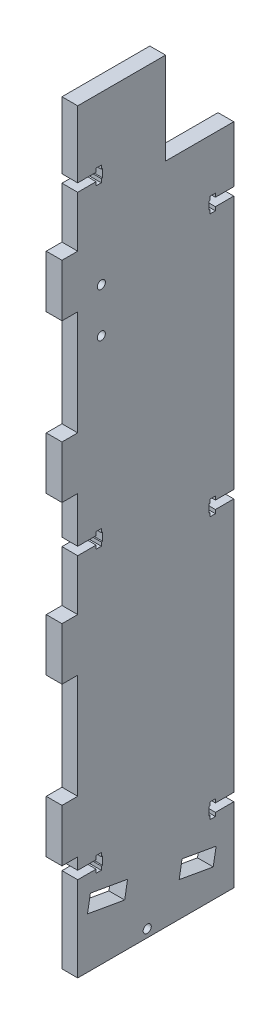
from build123d import *

# Parameters (mm, degrees)
DODANIE_WYCI_GNI_CIE1_DEPTH      = 65
DODANIE_WYCI_GNI_CIE1_DEPTH_BACK = 6.5
SZKIC1_W                         = 6
SZKIC1_H                         = 318
WYTNIJ_WYCI_GNI_CIE1_DEPTH       = 6
SZKIC4_W                         = 6
SZKIC4_H                         = 253
WYTNIJ_WYCI_GNI_CIE2_DEPTH       = 6
WYTNIJ_WYCI_GNI_CIE3_DEPTH       = 6
SZYK_LINIOWY2_COUNT              = 2
SZYK_LINIOWY2_PITCH              = 100
SZYK_LINIOWY2_COL_COUNT          = 2
SZYK_LINIOWY2_COL_PITCH          = 200
SZKIC6_W                         = 6
SZKIC6_H                         = 40
WYTNIJ_WYCI_GNI_CIE4_DEPTH       = 6
SZYK_LINIOWY3_COUNT              = 6
SZYK_LINIOWY3_PITCH              = 60
SZYK_LINIOWY3_COUNT_DIR2         = 2
SZYK_LINIOWY3_PITCH_DIR2         = 250
WYTNIJ_WYCI_GNI_CIE5_DEPTH       = 6
SZYK_LINIOWY4_COUNT              = 2
SZYK_LINIOWY4_PITCH              = 107
SZYK_LINIOWY4_COL_COUNT          = 2
SZYK_LINIOWY4_COL_PITCH          = 227
SZKIC9_R                         = 1.55
WYTNIJ_WYCI_GNI_CIE6_DEPTH       = 6
WYTNIJ_WYCI_GNI_CIE7_DEPTH       = 6
SZKIC13_R                        = 1.55
WYTNIJ_WYCI_GNI_CIE9_DEPTH       = 10


with BuildPart() as part:
    # Szkic1 → Dodanie-wyciągnięcie1 (new, two sides: drawn at the far end of the back side and taken through both)
    with BuildSketch(Plane.XY.offset(-DODANIE_WYCI_GNI_CIE1_DEPTH_BACK)):
        with Locations((-107, -325.603962956)):
            Rectangle(SZKIC1_W, SZKIC1_H)
    extrude(amount=DODANIE_WYCI_GNI_CIE1_DEPTH + DODANIE_WYCI_GNI_CIE1_DEPTH_BACK)

    # Szkic2 → Wytnij-wyciągnięcie1 (cut)
    with BuildSketch(Plane.ZY.offset(110)):
        Polygon((-6.5, -231.603962956), (25.5, -231.603962956), (25.5, -196.603962956), (65, -196.603962956), (65, -166.603962956), (-6.5, -166.603962956), align=None)
    extrude(amount=-WYTNIJ_WYCI_GNI_CIE1_DEPTH, mode=Mode.SUBTRACT)

    # Szkic4 → Wytnij-wyciągnięcie2 (cut)
    with BuildSketch(Plane.ZY.offset(110)):
        with Locations((-3.5, -358.103962956)):
            Rectangle(SZKIC4_W, SZKIC4_H)
    extrude(amount=-WYTNIJ_WYCI_GNI_CIE2_DEPTH, mode=Mode.SUBTRACT)

    # Szkic5 → Wytnij-wyciągnięcie3 (cut)
    with BuildSketch(Plane.ZY.offset(110)):
        Polygon((-0.5, -453.053962956), (-0.5, -456.153962956), (6.5, -456.153962956), (6.5, -457.528962956), (8.5, -457.528962956), (8.5, -456.153962956), (9, -456.153962956), (9, -453.053962956), (8.5, -453.053962956), (8.5, -451.678962956), (6.5, -451.678962956), (6.5, -453.053962956), align=None)
    wytnij_wyci_gni_cie3 = extrude(amount=-WYTNIJ_WYCI_GNI_CIE3_DEPTH, mode=Mode.SUBTRACT)

    # Szyk liniowy2: Wytnij-wyciągnięcie3 ×2
    with Locations(*[(0, i * SZYK_LINIOWY2_PITCH, 0) for i in range(1, SZYK_LINIOWY2_COUNT)]):
        add(wytnij_wyci_gni_cie3, mode=Mode.SUBTRACT)

    # Szyk liniowy2 col: Wytnij-wyciągnięcie3 ×2
    with Locations(*[(0, i * SZYK_LINIOWY2_COL_PITCH, 0) for i in range(1, SZYK_LINIOWY2_COL_COUNT)]):
        add(wytnij_wyci_gni_cie3, mode=Mode.SUBTRACT)

    # Szkic6 → Wytnij-wyciągnięcie4 (cut)
    with BuildSketch(Plane(origin=(-104, 0, 0), x_dir=(0, 0, -1), z_dir=(1, 0, 0))):
        with Locations((-62, -464.603962956)):
            Rectangle(SZKIC6_W, SZKIC6_H)
    wytnij_wyci_gni_cie4 = extrude(amount=-WYTNIJ_WYCI_GNI_CIE4_DEPTH, mode=Mode.SUBTRACT)

    # Szyk liniowy3: Wytnij-wyci_gni_cie4 6 × 2
    with Locations(*[Vector(0, 1, 0) * (i * SZYK_LINIOWY3_PITCH) + Vector(0, 1, 0) * (j * SZYK_LINIOWY3_PITCH_DIR2) for i in range(SZYK_LINIOWY3_COUNT) for j in range(SZYK_LINIOWY3_COUNT_DIR2) if (i, j) != (0, 0)]):
        add(wytnij_wyci_gni_cie4, mode=Mode.SUBTRACT)

    # Szkic7 → Wytnij-wyciągnięcie5 (cut)
    with BuildSketch(Plane(origin=(-104, 0, 0), x_dir=(0, 0, -1), z_dir=(1, 0, 0))):
        Polygon((-59, -449.053962956), (-59, -452.153962956), (-52, -452.153962956), (-52, -453.528962956), (-50, -453.528962956), (-50, -452.153962956), (-49.5, -452.153962956), (-49.5, -449.053962956), (-50, -449.053962956), (-50, -447.678962956), (-52, -447.678962956), (-52, -449.053962956), align=None)
    wytnij_wyci_gni_cie5 = extrude(amount=-WYTNIJ_WYCI_GNI_CIE5_DEPTH, mode=Mode.SUBTRACT)

    # Szyk liniowy4: Wytnij-wyciągnięcie5 ×2
    with Locations(*[(0, i * SZYK_LINIOWY4_PITCH, 0) for i in range(1, SZYK_LINIOWY4_COUNT)]):
        add(wytnij_wyci_gni_cie5, mode=Mode.SUBTRACT)

    # Szyk liniowy4 col: Wytnij-wyciągnięcie5 ×2
    with Locations(*[(0, i * SZYK_LINIOWY4_COL_PITCH, 0) for i in range(1, SZYK_LINIOWY4_COL_COUNT)]):
        add(wytnij_wyci_gni_cie5, mode=Mode.SUBTRACT)

    # Szkic9 → Wytnij-wyciągnięcie6 (cut)
    with BuildSketch(Plane.ZY.offset(110)):
        with Locations(Location((32.500000044, -481.603962956, 0), (0, 0, 270))):
            Circle(SZKIC9_R)
    extrude(amount=-WYTNIJ_WYCI_GNI_CIE6_DEPTH, mode=Mode.SUBTRACT)

    # Szkic11 → Wytnij-wyciągnięcie7 (cut)
    with BuildSketch(Plane(origin=(-104, 0, 0), x_dir=(0, 0, -1), z_dir=(1, 0, 0))):
        Polygon((-19.205244402, -465.162826439), (-6.219752977, -467.452518935), (-7.331101314, -473.755288555), (-20.316592739, -471.465596059), align=None)
        Polygon((-39.98468799, -461.498849891), (-54.165919634, -458.998316132), (-55.277267971, -465.301085752), (-41.096036327, -467.80161951), align=None)
    extrude(amount=-WYTNIJ_WYCI_GNI_CIE7_DEPTH, mode=Mode.SUBTRACT)

    # Szkic13 → Wytnij-wyciągnięcie9 (cut)
    with BuildSketch(Plane.ZY.offset(110)):
        with Locations(Location((50.000000044, -260.153962956, 0), (0, 0, 270))):
            Circle(SZKIC13_R)
        with Locations(Location((50.000000044, -277.053962956, 0), (0, 0, 270))):
            Circle(SZKIC13_R)
    extrude(amount=-WYTNIJ_WYCI_GNI_CIE9_DEPTH, mode=Mode.SUBTRACT)


solid = part.part
